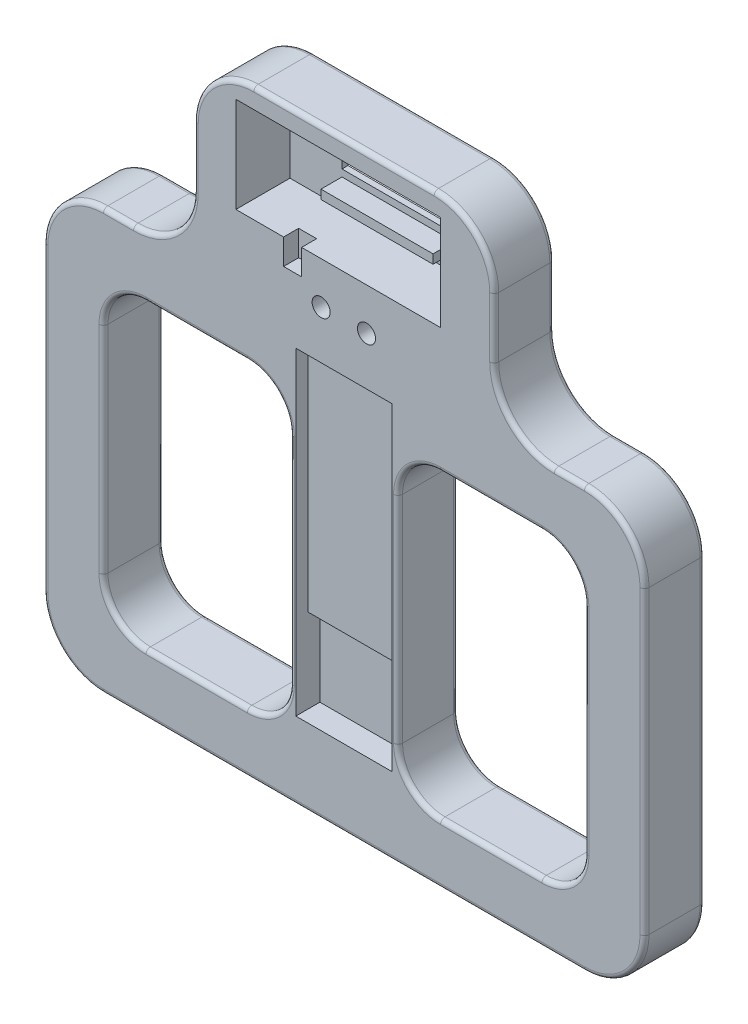
from build123d import *

# Parameters (mm, degrees)
IZIM1_W                      = 200
IZIM1_H                      = 230
Y_KSEKLIK_EKSTR_ZYON1_DEPTH  = 20
KES_EKSTR_ZYON11_DEPTH       = 75
IZIM4_W                      = 100
IZIM4_H                      = 230
KES_EKSTR_ZYON12_DEPTH       = 90
IZIM10_W                     = 32
IZIM10_H                     = 136
Y_KSEKLIK_EKSTR_ZYON6_DEPTH  = 20
KES_EKSTR_ZYON15_DEPTH       = 222
KES_EKSTR_ZYON15_DEPTH_BACK  = 26
Y_KSEKLIK_EKSTR_ZYON7_DEPTH  = 20
IZIM16_W                     = 37.3
IZIM16_H                     = 17
KES_EKSTR_ZYON16_DEPTH       = 20
KES_EKSTR_ZYON20_DEPTH       = 42
KES_EKSTR_ZYON21_DEPTH       = 42
IZIM20_W                     = 71.9
IZIM20_H                     = 2
KES_EKSTR_ZYON22_DEPTH       = 42
IZIM21_R                     = 1.5
Y_KSEKLIK_EKSTR_ZYON8_DEPTH  = 15
IZIM22_W                     = 3
IZIM22_H                     = 3
Y_KSEKLIK_EKSTR_ZYON9_DEPTH  = 8
IZIM23_W                     = 71.9
IZIM23_H                     = 36
Y_KSEKLIK_EKSTR_ZYON10_DEPTH = 1
KES_EKSTR_ZYON23_DEPTH       = 56
KES_EKSTR_ZYON23_DEPTH_BACK  = 86
IZIM24_W                     = 37.3
IZIM24_H                     = 17
IZIM26_W                     = 3
IZIM26_H                     = 3
Y_KSEKLIK_EKSTR_ZYON11_DEPTH = 8
IZIM27_W                     = 71.9
IZIM27_H                     = 2.056938391
Y_KSEKLIK_EKSTR_ZYON13_DEPTH = 19
Y_KSEKLIK_EKSTR_ZYON16_DEPTH = 19
IZIM31_W                     = 3
IZIM31_H                     = 3
Y_KSEKLIK_EKSTR_ZYON18_DEPTH = 8
IZIM32_R                     = 1.5
KES_EKSTR_ZYON24_DEPTH       = 32
IZIM33_R                     = 1.5
Y_KSEKLIK_EKSTR_ZYON19_DEPTH = 12
KES_EKSTR_ZYON27_DEPTH       = 1
KES_EKSTR_ZYON27_DEPTH_BACK  = 3
IZIM37_R                     = 2.5
KES_EKSTR_ZYON28_DEPTH       = 33
IZIM38_W                     = 34
IZIM38_H                     = 110
KES_EKSTR_ZYON33_DEPTH       = 42
IZIM40_W                     = 34
IZIM40_H                     = 110
Y_KSEKLIK_EKSTR_ZYON21_DEPTH = 15
IZIM41_W                     = 4
IZIM41_H                     = 8.5
KES_EKSTR_ZYON35_DEPTH       = 21
IZIM44_W                     = 4
IZIM44_H                     = 8.5
Y_KSEKLIK_EKSTR_ZYON23_DEPTH = 14
IZIM45_W                     = 1
IZIM45_H                     = 110
Y_KSEKLIK_EKSTR_ZYON25_DEPTH = 19
IZIM46_W                     = 12.0691428
IZIM46_H                     = 4.443061609
IZIM46_W_2                   = 12.8
Y_KSEKLIK_EKSTR_ZYON27_DEPTH = 8
IZIM47_W                     = 37.3
IZIM47_H                     = 3
Y_KSEKLIK_EKSTR_ZYON28_DEPTH = 8
KES_EKSTR_ZYON36_DEPTH       = 10
KES_EKSTR_ZYON36_DEPTH_BACK  = 38
IZIM48_W                     = 201.789222688
IZIM48_H                     = 30
KES_EKSTR_ZYON37_DEPTH       = 38
KES_EKSTR_ZYON37_DEPTH_BACK  = 38
KES_EKSTR_ZYON38_DEPTH       = 38
KES_EKSTR_ZYON38_DEPTH_BACK  = 38
SKETCH1_W                    = 32
SKETCH1_H                    = 28
CUT_EXTRUDE1_DEPTH           = 55
SKETCH2_W                    = 32
SKETCH2_H                    = 28
BOSS_EXTRUDE1_DEPTH          = 11
SKETCH3_W                    = 32
SKETCH3_H                    = 4
BOSS_EXTRUDE2_DEPTH          = 19
SKETCH4_W                    = 37.3
SKETCH4_H                    = 0.358806935
CUT_EXTRUDE3_DEPTH           = 11
SKETCH5_W                    = 37.3
SKETCH5_H                    = 0.35880693
BOSS_EXTRUDE3_DEPTH          = 9
SKETCH6_W                    = 37.3
SKETCH6_H                    = 0.358806935
BOSS_EXTRUDE4_DEPTH          = 2
SKETCH7_W                    = 6
SKETCH7_H                    = 8.5
CUT_EXTRUDE4_DEPTH           = 20
SKETCH8_W                    = 6
SKETCH8_H                    = 8.5
BOSS_EXTRUDE5_DEPTH          = 15
SKETCH9_R                    = 3
CUT_EXTRUDE5_DEPTH           = 27
SKETCH10_W                   = 12.0691428
SKETCH10_H                   = 4.443061609
CUT_EXTRUDE8_DEPTH           = 20
SKETCH11_W                   = 12.8
SKETCH11_H                   = 4.443061609
CUT_EXTRUDE9_DEPTH           = 22
SKETCH12_W                   = 12.0691428
SKETCH12_H                   = 4.443061609
SKETCH12_W_2                 = 12.8
BOSS_EXTRUDE6_DEPTH          = 9
CUT_EXTRUDE10_DEPTH          = 37
SKETCH14_R                   = 5
CUT_EXTRUDE12_DEPTH          = 5
FILLET6_R                    = 1.5


with BuildPart() as part:
    # Çizim1 → Yükseklik-Ekstrüzyon1 (new body)
    with BuildSketch(Plane.XY):
        with Locations((54.847725907, 89.085138461)):
            Rectangle(IZIM1_W, IZIM1_H)
    extrude(amount=Y_KSEKLIK_EKSTR_ZYON1_DEPTH)

    # Çizim2 → Kes-Ekstrüzyon11 (cut)
    with BuildSketch(Plane.XY):
        with BuildLine():
            Line((4.847725907, 164.085138461), (4.847725907, 184.085138461))
            ThreePointArc((4.847725907, 184.085138461), (10.705590284, 198.227274085), (24.847725907, 204.085138461))
            Line((24.847725907, 204.085138461), (-45.152274093, 204.085138461))
            Line((-45.152274093, 204.085138461), (-45.152274093, 124.085138461))
            ThreePointArc((-45.152274093, 124.085138461), (-39.294409716, 138.227274085), (-25.152274093, 144.085138461))
            Line((-25.152274093, 144.085138461), (-15.152274093, 144.085138461))
            ThreePointArc((-15.152274093, 144.085138461), (-1.010138469, 149.943002837), (4.847725907, 164.085138461))
        make_face()
        with BuildLine():
            Line((-45.152274093, -25.914861539), (-25.152274093, -25.914861539))
            ThreePointArc((-25.152274093, -25.914861539), (-39.294409716, -20.056997163), (-45.152274093, -5.914861539))
            Line((-45.152274093, -5.914861539), (-45.152274093, -25.914861539))
        make_face()
    extrude(amount=KES_EKSTR_ZYON11_DEPTH, mode=Mode.SUBTRACT)

    # Çizim4 → Kes-Ekstrüzyon12 (cut)
    with BuildSketch(Plane.XY):
        with Locations((104.847725907, 89.085138461)):
            Rectangle(IZIM4_W, IZIM4_H)
    extrude(amount=KES_EKSTR_ZYON12_DEPTH, mode=Mode.SUBTRACT)

    # Aynalama35: part across plane


with BuildPart() as part_1:
    add(part.part)
    add(part.part.mirror(Plane(origin=(54.847725907, 0, 90), x_dir=(0, 0, 1), z_dir=(-1, 0, 0))))

    # Çizim10 → Yükseklik-Ekstrüzyon6 (add)
    with BuildSketch(Plane.XY):
        Polygon((38.847725907, 129.085138461), (72.847725907, 129.085138461), (72.847725907, -10.914861539), (36.847725907, -10.914861539), (36.847725907, 129.085138461), align=None)
        with Locations((54.847725907, 59.085138461)):
            Rectangle(IZIM10_W, IZIM10_H, mode=Mode.SUBTRACT)
    extrude(amount=-Y_KSEKLIK_EKSTR_ZYON6_DEPTH)

    # Çizim11 → Kes-Ekstrüzyon15 (cut, two sides: drawn at the far end of the back side and taken through both)
    with BuildSketch(Plane(origin=(0, 0, 0), x_dir=(0, 0, -1), z_dir=(1, 0, 0)).offset(-KES_EKSTR_ZYON15_DEPTH_BACK)):
        Polygon((20, -10.914861539), (14, -10.914861539), (20, 129.085138461), align=None)
    extrude(amount=KES_EKSTR_ZYON15_DEPTH + KES_EKSTR_ZYON15_DEPTH_BACK, mode=Mode.SUBTRACT)

    # Çizim15 → Yükseklik-Ekstrüzyon7 (add)
    with BuildSketch(Plane.XY):
        with BuildLine():
            Line((-45.152274093, 124.085138461), (-45.152274093, -5.914861539))
            ThreePointArc((-45.152274093, -5.914861539), (-39.294409716, -20.056997163), (-25.152274093, -25.914861539))
            Line((-25.152274093, -25.914861539), (134.847725907, -25.914861539))
            ThreePointArc((134.847725907, -25.914861539), (148.989861531, -20.056997163), (154.847725907, -5.914861539))
            Line((154.847725907, -5.914861539), (154.847725907, 124.085138461))
            ThreePointArc((154.847725907, 124.085138461), (148.989861531, 138.227274085), (134.847725907, 144.085138461))
            Line((134.847725907, 144.085138461), (124.847725907, 144.085138461))
            ThreePointArc((124.847725907, 144.085138461), (110.705590284, 149.943002837), (104.847725907, 164.085138461))
            Line((104.847725907, 164.085138461), (104.847725907, 184.085138461))
            ThreePointArc((104.847725907, 184.085138461), (98.989861531, 198.227274085), (84.847725907, 204.085138461))
            Line((84.847725907, 204.085138461), (24.847725907, 204.085138461))
            ThreePointArc((24.847725907, 204.085138461), (10.705590284, 198.227274085), (4.847725907, 184.085138461))
            Line((4.847725907, 184.085138461), (4.847725907, 164.085138461))
            ThreePointArc((4.847725907, 164.085138461), (-1.010138469, 149.943002837), (-15.152274093, 144.085138461))
            Line((-15.152274093, 144.085138461), (-25.152274093, 144.085138461))
            ThreePointArc((-25.152274093, 144.085138461), (-39.294409716, 138.227274085), (-45.152274093, 124.085138461))
        make_face()
    extrude(amount=Y_KSEKLIK_EKSTR_ZYON7_DEPTH)

    # Çizim16 → Kes-Ekstrüzyon16 (cut)
    with BuildSketch(Plane.XY):
        with Locations((54.847725907, 185.585138461)):
            Rectangle(IZIM16_W, IZIM16_H)
    extrude(amount=KES_EKSTR_ZYON16_DEPTH, mode=Mode.SUBTRACT)

    # Çizim18 → Kes-Ekstrüzyon20 (cut)
    with BuildSketch(Plane(origin=(0, 0, 1), x_dir=(-1, 0, 0), z_dir=(0, 0, -1))):
        Polygon((-90.797725907, 197.585138461), (-90.797725907, 185.585138461), (-90.797725907, 163.585138461), (-18.897725907, 163.585138461), (-18.897725907, 197.585138461), align=None)
    extrude(amount=-KES_EKSTR_ZYON20_DEPTH, mode=Mode.SUBTRACT)

    # Çizim19 → Kes-Ekstrüzyon21 (cut)
    with BuildSketch(Plane(origin=(72.847725907, 0, 0), x_dir=(0, 0, -1), z_dir=(1, 0, 0))):
        Polygon((0, 129.085138461), (20, 129.085138461), (14, -10.914861539), (0, -10.914861539), align=None)
    extrude(amount=-KES_EKSTR_ZYON21_DEPTH, mode=Mode.SUBTRACT)

    # Çizim20 → Kes-Ekstrüzyon22 (cut)
    with BuildSketch(Plane(origin=(0, 0, 1), x_dir=(-1, 0, 0), z_dir=(0, 0, -1))):
        with Locations((-54.847725907, 198.585138461)):
            Rectangle(IZIM20_W, IZIM20_H)
    extrude(amount=-KES_EKSTR_ZYON22_DEPTH, mode=Mode.SUBTRACT)

    # Çizim21 → Yükseklik-Ekstrüzyon8 (add)
    with BuildSketch(Plane.XY.offset(1)):
        with Locations((27.697725907, 194.585138461)):
            Circle(IZIM21_R)
        with Locations((75.597725907, 194.585138461)):
            Circle(IZIM21_R)
    extrude(amount=Y_KSEKLIK_EKSTR_ZYON8_DEPTH)

    # Çizim22 → Yükseklik-Ekstrüzyon9 (add)
    with BuildSketch(Plane(origin=(0, 0, 1), x_dir=(-1, 0, 0), z_dir=(0, 0, -1))):
        with Locations((-71.997725907, 172.926331526)):
            Rectangle(IZIM22_W, IZIM22_H)
        with Locations((-37.697725907, 172.926331526)):
            Rectangle(IZIM22_W, IZIM22_H)
    extrude(amount=-Y_KSEKLIK_EKSTR_ZYON9_DEPTH)

    # Çizim23 → Yükseklik-Ekstrüzyon10 (add)
    with BuildSketch(Plane(origin=(0, 0, 1), x_dir=(-1, 0, 0), z_dir=(0, 0, -1))):
        with Locations((-54.847725907, 181.585138461)):
            Rectangle(IZIM23_W, IZIM23_H)
    extrude(amount=-Y_KSEKLIK_EKSTR_ZYON10_DEPTH)

    # Çizim24 → Kes-Ekstrüzyon23 (cut, two sides: drawn at the far end of the back side and taken through both)
    with BuildSketch(Plane(origin=(0, 0, 1), x_dir=(-1, 0, 0), z_dir=(0, 0, -1)).offset(-KES_EKSTR_ZYON23_DEPTH_BACK)):
        with Locations((-54.847725907, 185.585138461)):
            Rectangle(IZIM24_W, IZIM24_H)
    extrude(amount=KES_EKSTR_ZYON23_DEPTH + KES_EKSTR_ZYON23_DEPTH_BACK, mode=Mode.SUBTRACT)

    # Çizim26 → Yükseklik-Ekstrüzyon11 (add)
    with BuildSketch(Plane(origin=(0, 0, 1), x_dir=(-1, 0, 0), z_dir=(0, 0, -1))):
        with Locations((-37.697725907, 172.926331526)):
            Rectangle(IZIM26_W, IZIM26_H)
    extrude(amount=-Y_KSEKLIK_EKSTR_ZYON11_DEPTH)

    # Çizim27 → Yükseklik-Ekstrüzyon13 (add)
    with BuildSketch(Plane(origin=(0, 0, 1), x_dir=(-1, 0, 0), z_dir=(0, 0, -1))):
        with Locations((-54.847725907, 198.556669266)):
            Rectangle(IZIM27_W, IZIM27_H)
    extrude(amount=-Y_KSEKLIK_EKSTR_ZYON13_DEPTH)

    # Çizim29 → Yükseklik-Ekstrüzyon16 (add)
    with BuildSketch(Plane(origin=(0, 0, 1), x_dir=(-1, 0, 0), z_dir=(0, 0, -1))):
        Polygon((-18.897725907, 163.585138461), (-18.897725907, 165.785138461), (-86.897725907, 165.785138461), (-86.897725907, 197.52820007), (-90.797725907, 197.52820007), (-90.797725907, 163.585138461), align=None)
    extrude(amount=-Y_KSEKLIK_EKSTR_ZYON16_DEPTH)

    # Çizim31 → Yükseklik-Ekstrüzyon18 (add)
    with BuildSketch(Plane(origin=(0, 0, 1), x_dir=(-1, 0, 0), z_dir=(0, 0, -1))):
        with Locations((-37.697725907, 172.926331526)):
            Rectangle(IZIM31_W, IZIM31_H)
        with Locations((-71.997725907, 172.926331526)):
            Rectangle(IZIM31_W, IZIM31_H)
    extrude(amount=-Y_KSEKLIK_EKSTR_ZYON18_DEPTH)

    # Çizim32 → Kes-Ekstrüzyon24 (cut)
    with BuildSketch(Plane(origin=(0, 0, 1), x_dir=(-1, 0, 0), z_dir=(0, 0, -1))):
        with Locations((-27.697725907, 194.585138461)):
            Circle(IZIM32_R)
        with Locations((-75.597725907, 194.585138461)):
            Circle(IZIM32_R)
    extrude(amount=-KES_EKSTR_ZYON24_DEPTH, mode=Mode.SUBTRACT)

    # Çizim33 → Yükseklik-Ekstrüzyon19 (add)
    with BuildSketch(Plane(origin=(0, 0, 1), x_dir=(-1, 0, 0), z_dir=(0, 0, -1))):
        with Locations((-27.697725907, 194.585138461)):
            Circle(IZIM33_R)
        with Locations((-75.597725907, 194.585138461)):
            Circle(IZIM33_R)
    extrude(amount=-Y_KSEKLIK_EKSTR_ZYON19_DEPTH)

    # Çizim34 → Kes-Ekstrüzyon27 (cut, two sides: drawn at the far end of the back side and taken through both)
    with BuildSketch(Plane(origin=(0, 0, 1), x_dir=(-1, 0, 0), z_dir=(0, 0, -1)).offset(-KES_EKSTR_ZYON27_DEPTH_BACK)):
        Polygon((-50.869562549, 153.785138461), (-51.995395574, 151.835138461), (-49.628259471, 147.735138461), (-44.893987263, 147.735138461), (-42.52685116, 151.835138461), (-44.893987263, 155.935138461), (-49.628259471, 155.935138461), align=None)
        Polygon((-64.714862011, 155.885138461), (-67.081998115, 151.785138461), (-64.714862011, 147.685138461), (-59.980589804, 147.685138461), (-57.6134537, 151.785138461), (-58.768154238, 153.785138461), (-59.980589804, 155.885138461), align=None)
    extrude(amount=KES_EKSTR_ZYON27_DEPTH + KES_EKSTR_ZYON27_DEPTH_BACK, mode=Mode.SUBTRACT)

    # Çizim37 → Kes-Ekstrüzyon28 (cut)
    with BuildSketch(Plane(origin=(0, 0, 1), x_dir=(-1, 0, 0), z_dir=(0, 0, -1))):
        with Locations((-62.347725907, 151.785138461)):
            Circle(IZIM37_R)
        with Locations((-47.261123367, 151.785138461)):
            Circle(IZIM37_R)
    extrude(amount=-KES_EKSTR_ZYON28_DEPTH, mode=Mode.SUBTRACT)

    # Çizim38 → Kes-Ekstrüzyon33 (cut)
    with BuildSketch(Plane(origin=(0, 0, 1), x_dir=(-1, 0, 0), z_dir=(0, 0, -1))):
        with Locations((-54.847725907, 84.785138461)):
            Rectangle(IZIM38_W, IZIM38_H)
    extrude(amount=-KES_EKSTR_ZYON33_DEPTH, mode=Mode.SUBTRACT)

    # Çizim40 → Yükseklik-Ekstrüzyon21 (add)
    with BuildSketch(Plane(origin=(0, 0, 1), x_dir=(-1, 0, 0), z_dir=(0, 0, -1))):
        with Locations((-54.847725907, 84.785138461)):
            Rectangle(IZIM40_W, IZIM40_H)
    extrude(amount=-Y_KSEKLIK_EKSTR_ZYON21_DEPTH)

    # Çizim41 → Kes-Ekstrüzyon35 (cut)
    with BuildSketch(Plane(origin=(0, 0, 1), x_dir=(-1, 0, 0), z_dir=(0, 0, -1))):
        with Locations((-37.761123367, 161.535138461)):
            Rectangle(IZIM41_W, IZIM41_H)
    extrude(amount=-KES_EKSTR_ZYON35_DEPTH, mode=Mode.SUBTRACT)

    # Çizim44 → Yükseklik-Ekstrüzyon23 (add)
    with BuildSketch(Plane(origin=(0, 0, 1), x_dir=(-1, 0, 0), z_dir=(0, 0, -1))):
        with Locations((-37.761123367, 161.535138461)):
            Rectangle(IZIM44_W, IZIM44_H)
    extrude(amount=-Y_KSEKLIK_EKSTR_ZYON23_DEPTH)

    # Çizim45 → Yükseklik-Ekstrüzyon25 (add)
    with BuildSketch(Plane(origin=(0, 0, 1), x_dir=(-1, 0, 0), z_dir=(0, 0, -1))):
        with Locations((-38.347725907, 84.785138461)):
            Rectangle(IZIM45_W, IZIM45_H)
        with Locations((-71.347725907, 84.785138461)):
            Rectangle(IZIM45_W, IZIM45_H)
    extrude(amount=-Y_KSEKLIK_EKSTR_ZYON25_DEPTH)

    # Çizim46 → Yükseklik-Ekstrüzyon27 (add)
    with BuildSketch(Plane(origin=(0, 0, 1), x_dir=(-1, 0, 0), z_dir=(0, 0, -1))):
        with Locations((-24.932297307, 195.306669266)):
            Rectangle(IZIM46_W, IZIM46_H)
        with Locations((-80.497725907, 195.306669266)):
            Rectangle(IZIM46_W_2, IZIM46_H)
    extrude(amount=-Y_KSEKLIK_EKSTR_ZYON27_DEPTH)

    # Çizim47 → Yükseklik-Ekstrüzyon28 (add)
    with BuildSketch(Plane(origin=(0, 0, 1), x_dir=(-1, 0, 0), z_dir=(0, 0, -1))):
        with Locations((-54.847725907, 172.926331526)):
            Rectangle(IZIM47_W, IZIM47_H)
    extrude(amount=-Y_KSEKLIK_EKSTR_ZYON28_DEPTH)

    # Çizim48 → Kes-Ekstrüzyon36 (cut, two sides: drawn at the far end of the back side and taken through both)
    with BuildSketch(Plane(origin=(0, 0, 1), x_dir=(-1, 0, 0), z_dir=(0, 0, -1)).offset(-KES_EKSTR_ZYON36_DEPTH_BACK)):
        with Locations((-53.953114563, -10.914861539)):
            Rectangle(IZIM48_W, IZIM48_H)
    extrude(amount=KES_EKSTR_ZYON36_DEPTH + KES_EKSTR_ZYON36_DEPTH_BACK, mode=Mode.SUBTRACT)

    # Çizim49 → Kes-Ekstrüzyon37 (cut, two sides: drawn at the far end of the back side and taken through both)
    with BuildSketch(Plane(origin=(0, 0, 1), x_dir=(-1, 0, 0), z_dir=(0, 0, -1)).offset(-KES_EKSTR_ZYON37_DEPTH_BACK)):
        with BuildLine():
            Line((-154.847725907, 4.085138461), (-134.847725907, 4.085138461))
            ThreePointArc((-134.847725907, 4.085138461), (-148.989861531, 9.943002837), (-154.847725907, 24.085138461))
            Line((-154.847725907, 24.085138461), (-154.847725907, 4.085138461))
        make_face()
    extrude(amount=KES_EKSTR_ZYON37_DEPTH + KES_EKSTR_ZYON37_DEPTH_BACK, mode=Mode.SUBTRACT)

    # Çizim50 → Kes-Ekstrüzyon38 (cut, two sides: drawn at the far end of the back side and taken through both)
    with BuildSketch(Plane(origin=(0, 0, 1), x_dir=(-1, 0, 0), z_dir=(0, 0, -1)).offset(-KES_EKSTR_ZYON38_DEPTH_BACK)):
        with BuildLine():
            Line((45.152274093, 4.085138461), (25.152274093, 4.085138461))
            ThreePointArc((25.152274093, 4.085138461), (39.294409716, 9.943002837), (45.152274093, 24.085138461))
            Line((45.152274093, 24.085138461), (45.152274093, 4.085138461))
        make_face()
    extrude(amount=KES_EKSTR_ZYON38_DEPTH + KES_EKSTR_ZYON38_DEPTH_BACK, mode=Mode.SUBTRACT)

    # Sketch1 → Cut-Extrude1 (cut)
    with BuildSketch(Plane(origin=(0, 0, 1), x_dir=(-1, 0, 0), z_dir=(0, 0, -1))):
        with Locations((-54.847725907, 43.785138461)):
            Rectangle(SKETCH1_W, SKETCH1_H)
    extrude(amount=-CUT_EXTRUDE1_DEPTH, mode=Mode.SUBTRACT)

    # Sketch2 → Boss-Extrude1 (add)
    with BuildSketch(Plane(origin=(0, 0, 1), x_dir=(-1, 0, 0), z_dir=(0, 0, -1))):
        with Locations((-54.847725907, 43.785138461)):
            Rectangle(SKETCH2_W, SKETCH2_H)
    extrude(amount=-BOSS_EXTRUDE1_DEPTH)

    # Sketch3 → Boss-Extrude2 (add)
    with BuildSketch(Plane(origin=(0, 0, 1), x_dir=(-1, 0, 0), z_dir=(0, 0, -1))):
        with Locations((-54.847725907, 137.785138461)):
            Rectangle(SKETCH3_W, SKETCH3_H)
    extrude(amount=-BOSS_EXTRUDE2_DEPTH)

    # Sketch4 → Cut-Extrude3 (cut)
    with BuildSketch(Plane.XY):
        with Locations((54.847725907, 171.605734993)):
            Rectangle(SKETCH4_W, SKETCH4_H)
    extrude(amount=CUT_EXTRUDE3_DEPTH, mode=Mode.SUBTRACT)

    # Sketch5 → Boss-Extrude3 (add)
    with BuildSketch(Plane.XY):
        with Locations((54.847725907, 174.605734991)):
            Rectangle(SKETCH5_W, SKETCH5_H)
    extrude(amount=BOSS_EXTRUDE3_DEPTH)

    # Sketch6 → Boss-Extrude4 (add)
    with BuildSketch(Plane.XY):
        with Locations((54.847725907, 171.605734993)):
            Rectangle(SKETCH6_W, SKETCH6_H)
    extrude(amount=BOSS_EXTRUDE4_DEPTH)

    # Sketch7 → Cut-Extrude4 (cut)
    with BuildSketch(Plane.XY):
        with Locations((37.761123367, 161.535138461)):
            Rectangle(SKETCH7_W, SKETCH7_H)
    extrude(amount=CUT_EXTRUDE4_DEPTH, mode=Mode.SUBTRACT)

    # Sketch8 → Boss-Extrude5 (add)
    with BuildSketch(Plane.XY):
        with Locations((37.761123367, 161.535138461)):
            Rectangle(SKETCH8_W, SKETCH8_H)
    extrude(amount=BOSS_EXTRUDE5_DEPTH)

    # Sketch9 → Cut-Extrude5 (cut)
    with BuildSketch(Plane.XY):
        with Locations((62.347725907, 151.785138461)):
            Circle(SKETCH9_R)
        with Locations((47.261123367, 151.785138461)):
            Circle(SKETCH9_R)
    extrude(amount=CUT_EXTRUDE5_DEPTH, mode=Mode.SUBTRACT)

    # Sketch10 → Cut-Extrude8 (cut)
    with BuildSketch(Plane.XY):
        with Locations((24.932297307, 195.306669266)):
            Rectangle(SKETCH10_W, SKETCH10_H)
    extrude(amount=CUT_EXTRUDE8_DEPTH, mode=Mode.SUBTRACT)

    # Sketch11 → Cut-Extrude9 (cut)
    with BuildSketch(Plane.XY):
        with Locations((80.497725907, 195.306669266)):
            Rectangle(SKETCH11_W, SKETCH11_H)
    extrude(amount=CUT_EXTRUDE9_DEPTH, mode=Mode.SUBTRACT)

    # Sketch12 → Boss-Extrude6 (add)
    with BuildSketch(Plane.XY):
        with Locations((24.932297307, 195.306669266)):
            Rectangle(SKETCH12_W, SKETCH12_H)
        with Locations((80.497725907, 195.306669266)):
            Rectangle(SKETCH12_W_2, SKETCH12_H)
    extrude(amount=BOSS_EXTRUDE6_DEPTH)

    # Sketch13 → Cut-Extrude10 (cut)
    with BuildSketch(Plane.XY):
        with BuildLine():
            Line((-25.152274089, 109.943002837), (-25.152274089, 38.227274077))
            ThreePointArc((-25.152274089, 38.227274077), (-21.010138466, 28.22727408), (-11.010138469, 24.085138457))
            Line((-11.010138469, 24.085138457), (22.705590287, 24.085138457))
            ThreePointArc((22.705590287, 24.085138457), (32.705590285, 28.22727408), (36.847725907, 38.227274077))
            Line((36.847725907, 38.227274077), (36.847725907, 109.943002837))
            ThreePointArc((36.847725907, 109.943002837), (32.705590285, 119.943002835), (22.705590287, 124.085138457))
            Line((22.705590287, 124.085138457), (-11.010138469, 124.085138457))
            ThreePointArc((-11.010138469, 124.085138457), (-21.010138466, 119.943002835), (-25.152274089, 109.943002837))
        make_face()
        with BuildLine():
            Line((120.705590284, 24.085138457), (86.989861527, 24.085138457))
            ThreePointArc((86.989861527, 24.085138457), (76.98986153, 28.22727408), (72.847725907, 38.227274077))
            Line((72.847725907, 38.227274077), (72.847725907, 109.943002837))
            ThreePointArc((72.847725907, 109.943002837), (76.98986153, 119.943002835), (86.989861527, 124.085138457))
            Line((86.989861527, 124.085138457), (120.705590284, 124.085138457))
            ThreePointArc((120.705590284, 124.085138457), (130.705590281, 119.943002835), (134.847725904, 109.943002837))
            Line((134.847725904, 109.943002837), (134.847725904, 38.227274077))
            ThreePointArc((134.847725904, 38.227274077), (130.705590281, 28.22727408), (120.705590284, 24.085138457))
        make_face()
    extrude(amount=CUT_EXTRUDE10_DEPTH, mode=Mode.SUBTRACT)

    # Sketch14 → Cut-Extrude12 (cut)
    with BuildSketch(Plane.XY):
        with Locations((47.261123367, 151.785138461)):
            Circle(SKETCH14_R)
        with Locations((62.347725907, 151.785138461)):
            Circle(SKETCH14_R)
    extrude(amount=CUT_EXTRUDE12_DEPTH, mode=Mode.SUBTRACT)

    # Fillet6
    fillet6_edges = [part_1.edges().sort_by_distance(p)[0] for p in [
        (76.98986153, 28.22727408, 20),
        (103.847725906, 24.085138457, 20),
        (130.705590281, 28.22727408, 20),
        (134.847725904, 74.085138457, 20),
        (130.705590281, 119.943002835, 20),
        (103.847725906, 124.085138457, 20),
        (76.98986153, 119.943002835, 20),
        (76.98986153, 119.943002835, 0),
        (103.847725906, 124.085138457, 0),
        (130.705590281, 119.943002835, 0),
        (134.847725904, 74.085138457, 0),
        (130.705590281, 28.22727408, 0),
        (103.847725906, 24.085138457, 0),
        (76.98986153, 28.22727408, 0),
        (-21.010138466, 119.943002835, 0),
        (5.847725909, 124.085138457, 0),
        (32.705590285, 119.943002835, 0),
        (36.847725907, 74.085138457, 0),
        (32.705590285, 28.22727408, 0),
        (5.847725909, 24.085138457, 0),
        (-21.010138466, 28.22727408, 0),
        (-39.294409716, 138.227274085, 20),
        (-20.152274093, 144.085138461, 20),
        (-1.010138469, 149.943002837, 20),
        (4.847725907, 174.085138461, 20),
        (10.705590284, 198.227274085, 20),
        (54.847725907, 204.085138461, 20),
        (98.989861531, 198.227274085, 20),
        (104.847725907, 174.085138461, 20),
        (110.705590284, 149.943002837, 20),
        (129.847725907, 144.085138461, 20),
        (148.989861531, 138.227274085, 20),
        (154.847725907, 74.085138461, 20),
        (148.989861531, 9.943002837, 20),
        (54.847725907, 4.085138461, 20),
        (-39.294409716, 9.943002837, 20),
        (-39.294409716, 138.227274085, 0),
        (-20.152274093, 144.085138461, 0),
        (-1.010138469, 149.943002837, 0),
        (4.847725907, 174.085138461, 0),
        (10.705590284, 198.227274085, 0),
        (54.847725907, 204.085138461, 0),
        (98.989861531, 198.227274085, 0),
        (104.847725907, 174.085138461, 0),
        (110.705590284, 149.943002837, 0),
        (129.847725907, 144.085138461, 0),
        (148.989861531, 138.227274085, 0),
        (154.847725907, 74.085138461, 0),
        (148.989861531, 9.943002837, 0),
        (54.847725907, 4.085138461, 0),
        (-39.294409716, 9.943002837, 0),
        (-21.010138466, 28.22727408, 20),
        (5.847725909, 24.085138457, 20),
        (32.705590285, 28.22727408, 20),
        (36.847725907, 74.085138457, 20),
        (32.705590285, 119.943002835, 20),
        (5.847725909, 124.085138457, 20),
        (-21.010138466, 119.943002835, 20),
        (72.847725907, 74.085138457, 20),
        (72.847725907, 74.085138457, 0),
        (-25.152274089, 74.085138457, 0),
        (-45.152274093, 74.085138461, 20),
        (-45.152274093, 74.085138461, 0),
        (-25.152274089, 74.085138457, 20),
    ]]
    fillet(fillet6_edges, radius=FILLET6_R)


solid = part_1.part
